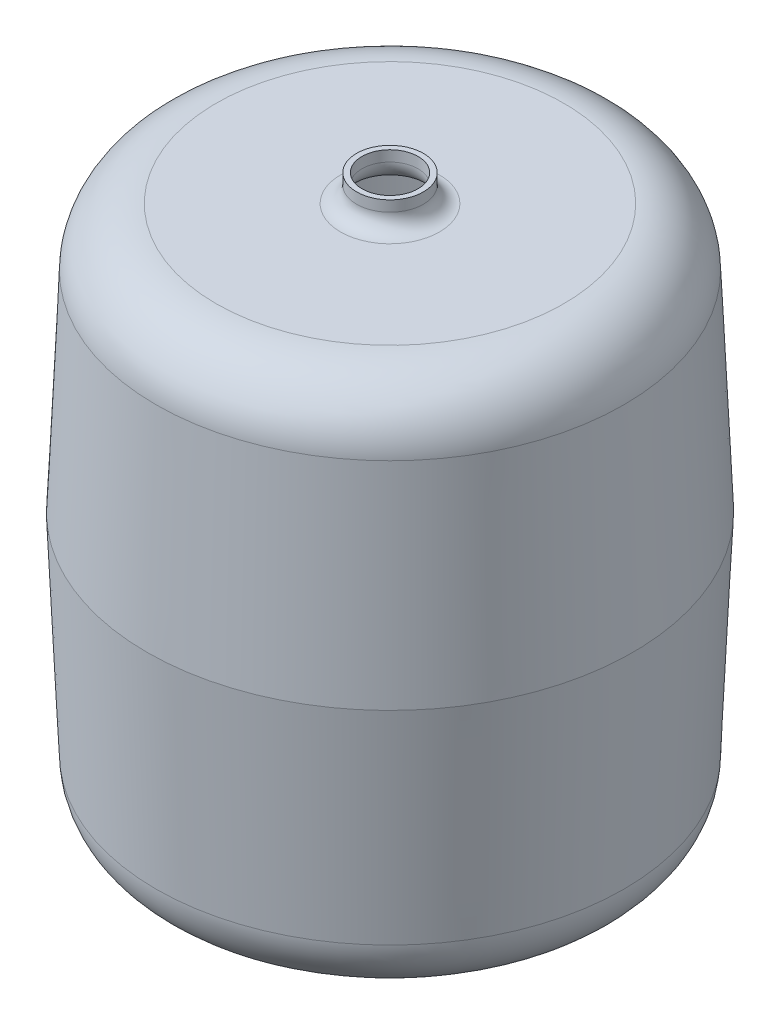
from build123d import *


with BuildPart() as part:
    # Sketch1 → Revolve1 (revolve)
    with BuildSketch(Plane.XY, mode=Mode.PRIVATE) as revolve1_sk:
        with BuildLine():
            Line((0, 0), (130.042830029, 0))
            ThreePointArc((130.042830029, 0), (161.160917539, 12.493621707), (175, 43.037127569))
            Line((175, 43.037127569), (181.853147012, 200))
            Line((181.853147012, 200), (175, 356.962872431))
            ThreePointArc((175, 356.962872431), (161.160917539, 387.506378293), (130.042830029, 400))
            Line((130.042830029, 400), (37, 400))
            ThreePointArc((37, 400), (28.514718626, 403.514718626), (25, 412))
            Line((25, 412), (25, 420))
            Line((25, 420), (21, 420))
            Line((21, 420), (21, 412))
            ThreePointArc((21, 412), (25.686291501, 400.686291501), (37, 396))
            Line((37, 396), (130.042830029, 396))
            ThreePointArc((130.042830029, 396), (158.394865316, 384.616922444), (171.003807114, 356.788394882))
            Line((171.003807114, 356.788394882), (177.849336271, 200))
            Line((177.849336271, 200), (171.003807114, 43.211605118))
            ThreePointArc((171.003807114, 43.211605118), (158.394865316, 15.383077556), (130.042830029, 4))
            Line((130.042830029, 4), (0, 4))
            Line((0, 4), (0, 0))
        make_face()
    revolve(revolve1_sk.sketch.rotate(Axis((0, 434.412205838, 0), (0, -1, 0)), 90), axis=Axis((0, 434.412205838, 0), (0, -1, 0)))


solid = part.part
